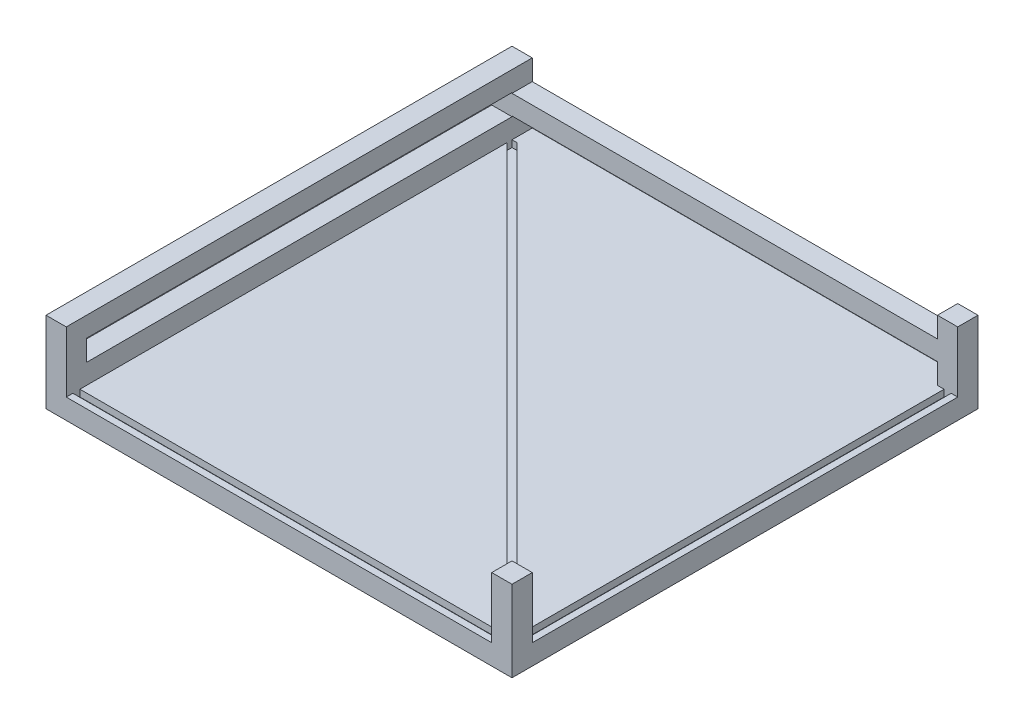
from build123d import *

# Parameters (mm, degrees)
SKETCH1_W          = 115
SKETCH1_H          = 115
BASE_DEPTH         = 5
SKETCH2_W          = 115
SKETCH2_H          = 15
SKETCH2_W_2        = 105
SKETCH2_H_2        = 5.16
FRAME1_DEPTH       = 5
FRAME2_START       = -5
FRAME2_DEPTH       = 5
SKETCH5_W          = 5
SKETCH5_H          = 5
POST_DEPTH         = 15
SKETCH6_W          = 1.746666666
SKETCH6_H          = 105
SKETCH6_W_2        = 105
SKETCH6_H_2        = 1.746666666
TRACKS_DEPTH       = 1.666666667
CUT_EXTRUDE1_DEPTH = 1.67


with BuildPart() as part:
    # Sketch1 → Base (new body)
    with BuildSketch(Plane(origin=(0, 0, 0), x_dir=(1, 0, 0), z_dir=(0, 1, 0))):
        Rectangle(SKETCH1_W, SKETCH1_H)
    extrude(amount=BASE_DEPTH)

    # Sketch2 → Frame1 (add)
    with BuildSketch(Plane.ZY.offset(57.5)):
        with Locations((0, 12.5)):
            Rectangle(SKETCH2_W, SKETCH2_H)
        with Locations((0, 12.5)):
            Rectangle(SKETCH2_W_2, SKETCH2_H_2, mode=Mode.SUBTRACT)
    extrude(amount=-FRAME1_DEPTH)

    # Sketch4 → Frame2 (add)
    with BuildSketch(Plane(origin=(0, 0, -57.5), x_dir=(-1, 0, 0), z_dir=(0, 0, -1)).offset(FRAME2_START)):
        Polygon((-57.5, 5), (-52.5, 5), (-52.5, 10.08), (52.5, 10.08), (52.5, 5), (57.5, 5), (57.5, 20), (52.5, 20), (52.5, 14.92), (-52.5, 14.92), (-52.5, 20), (-57.5, 20), align=None)
    extrude(amount=FRAME2_DEPTH)

    # Sketch5 → Post (add)
    with BuildSketch(Plane(origin=(0, 5, 0), x_dir=(1, 0, 0), z_dir=(0, 1, 0))):
        with Locations((55, -55)):
            Rectangle(SKETCH5_W, SKETCH5_H)
    extrude(amount=POST_DEPTH)

    # Sketch6 → Tracks (cut)
    with BuildSketch(Plane(origin=(0, 5, 0), x_dir=(1, 0, 0), z_dir=(0, 1, 0))):
        with Locations((55, 0)):
            Rectangle(SKETCH6_W, SKETCH6_H)
        with Locations((0, -55)):
            Rectangle(SKETCH6_W_2, SKETCH6_H_2)
    extrude(amount=-TRACKS_DEPTH, mode=Mode.SUBTRACT)

    # Sketch7 → Cut-Extrude1 (cut)
    with BuildSketch(Plane(origin=(0, 5, 0), x_dir=(1, 0, 0), z_dir=(0, 1, 0))):
        Polygon((53.735079844, -52.5), (-51.264920156, 52.5), (-52.5, 52.5), (-52.5, 51.264920156), (52.5, -53.735079844), (52.5, -52.5), align=None)
    extrude(amount=-CUT_EXTRUDE1_DEPTH, mode=Mode.SUBTRACT)


solid = part.part
